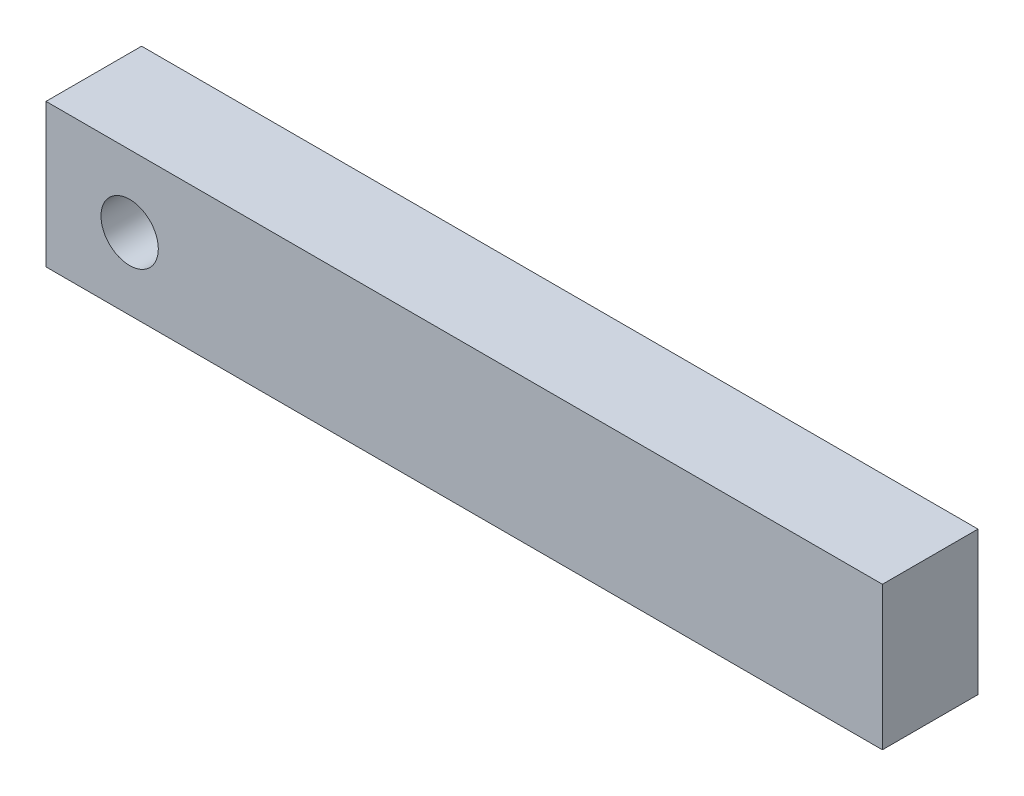
from build123d import *

# Parameters (mm, degrees)
SKETCH_8_W          = 350
SKETCH_8_H          = 60
EXTRUDE_1_DEPTH     = 40
SKETCH_9_R          = 12
CUT_EXTRUDE_1_DEPTH = 183.002747232


with BuildPart() as part:
    # 草图8 → 凸台-拉伸1 (new body)
    with BuildSketch(Plane.XY):
        Rectangle(SKETCH_8_W, SKETCH_8_H)
    extrude(amount=EXTRUDE_1_DEPTH)

    # 草图9 → 切除-拉伸1 (cut, through all)
    with BuildSketch(Plane.XY.offset(40)):
        with Locations((-140, 0)):
            Circle(SKETCH_9_R)
    extrude(amount=-CUT_EXTRUDE_1_DEPTH, mode=Mode.SUBTRACT)


solid = part.part
